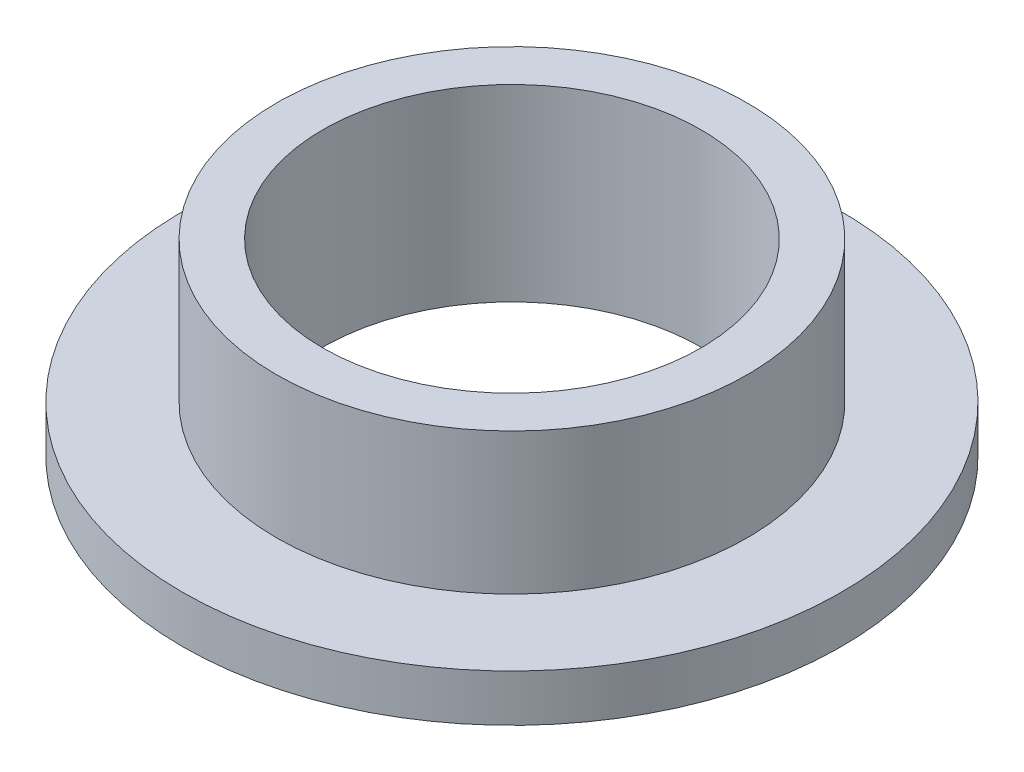
from build123d import *

# Parameters (mm, degrees)
SKETCH2_R           = 7.9375
SKETCH2_R_2         = 6.3754
BOSS_EXTRUDE1_DEPTH = 6.35
SKETCH3_R           = 11.1125
SKETCH3_R_2         = 7.9375
BOSS_EXTRUDE2_DEPTH = 1.5875


with BuildPart() as part:
    # Sketch2 → Boss-Extrude1 (new body)
    with BuildSketch(Plane(origin=(0, 0, 0), x_dir=(1, 0, 0), z_dir=(0, 1, 0))):
        with Locations(Location((0, 0, 0), (0, 0, 270))):
            Circle(SKETCH2_R)
        with Locations(Location((0, 0, 0), (0, 0, 270))):
            Circle(SKETCH2_R_2, mode=Mode.SUBTRACT)
    extrude(amount=BOSS_EXTRUDE1_DEPTH)

    # Sketch3 → Boss-Extrude2 (add)
    with BuildSketch(Plane(origin=(0, 0, 0), x_dir=(1, 0, 0), z_dir=(0, 1, 0))):
        with Locations(Location((0, 0, 0), (0, 0, 270))):
            Circle(SKETCH3_R)
        with Locations(Location((0, 0, 0), (0, 0, 270))):
            Circle(SKETCH3_R_2, mode=Mode.SUBTRACT)
    extrude(amount=BOSS_EXTRUDE2_DEPTH)


solid = part.part
